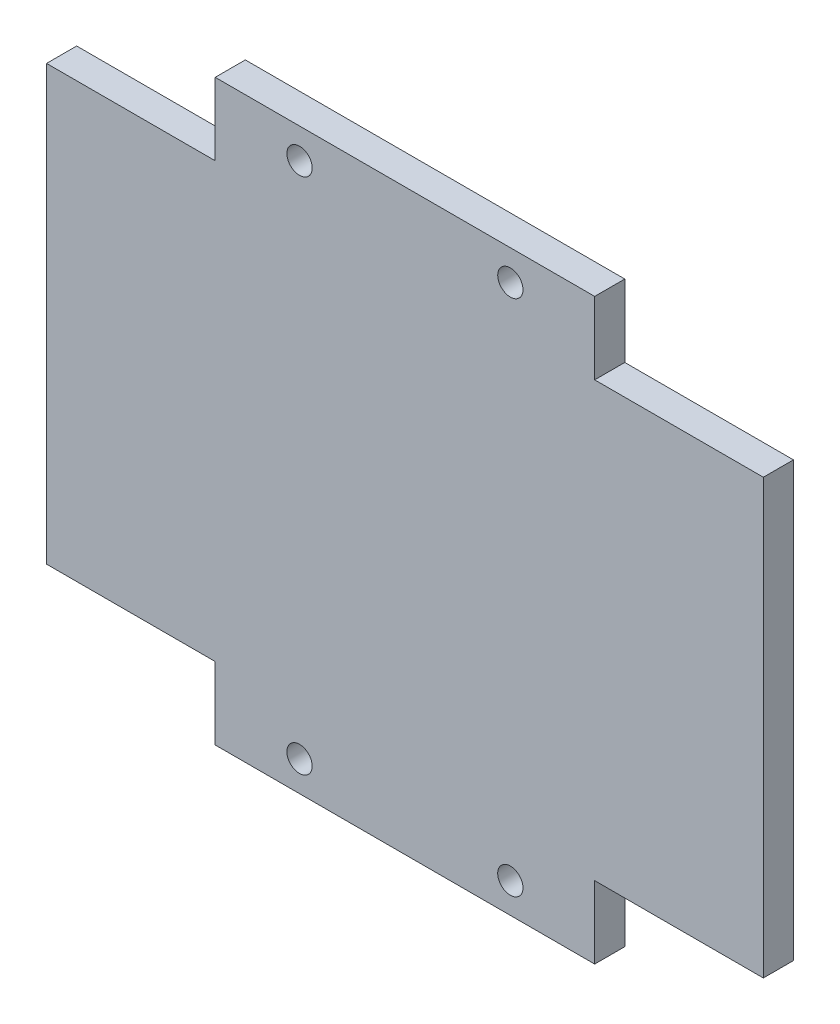
from build123d import *

# Parameters (mm, degrees)
SKETCH2_W           = 63
SKETCH2_H           = 96
BOSS_EXTRUDE1_DEPTH = 5
SKETCH3_R           = 2.1
CUT_EXTRUDE1_DEPTH  = 5
SKETCH4_W           = 28
SKETCH4_H           = 72
BOSS_EXTRUDE2_DEPTH = 5


with BuildPart() as part:
    # Sketch2 → Boss-Extrude1 (new body)
    with BuildSketch(Plane.XY):
        with Locations((31.5, 48)):
            Rectangle(SKETCH2_W, SKETCH2_H)
    extrude(amount=BOSS_EXTRUDE1_DEPTH)

    # Sketch3 → Cut-Extrude1 (cut)
    with BuildSketch(Plane.XY.offset(5)):
        with Locations((14, 91)):
            Circle(SKETCH3_R)
        with Locations(Location((49, 91, 0), (0, 0, 180))):
            Circle(SKETCH3_R)
        with Locations((49, 5)):
            Circle(SKETCH3_R)
        with Locations(Location((14, 5, 0), (0, 0, 180))):
            Circle(SKETCH3_R)
    extrude(amount=-CUT_EXTRUDE1_DEPTH, mode=Mode.SUBTRACT)

    # Sketch4 → Boss-Extrude2 (add)
    with BuildSketch(Plane.XY.offset(5)):
        with Locations((77, 48)):
            Rectangle(SKETCH4_W, SKETCH4_H)
        with Locations((-14, 48)):
            Rectangle(SKETCH4_W, SKETCH4_H)
    extrude(amount=-BOSS_EXTRUDE2_DEPTH)


solid = part.part
